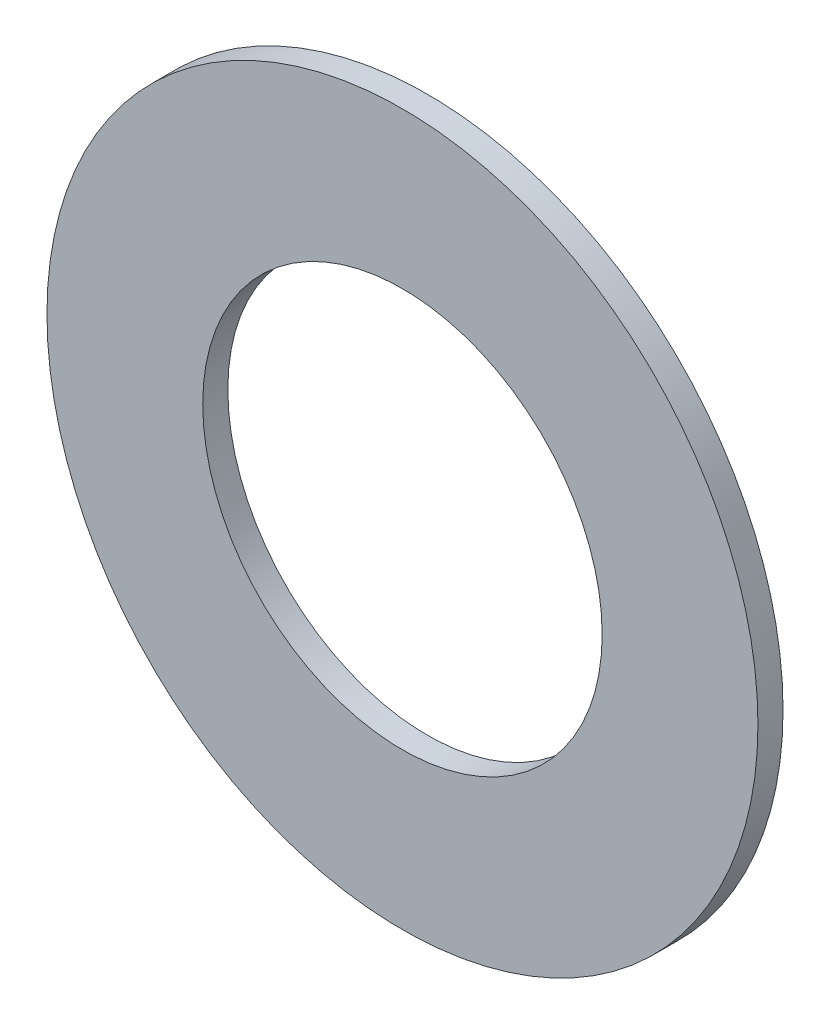
from build123d import *

# Parameters (mm, degrees)
SKETCH3_R           = 22.25
SKETCH3_R_2         = 12.5
BOSS_EXTRUDE1_DEPTH = 1.57


with BuildPart() as part:
    # Sketch3 → Boss-Extrude1 (new body)
    with BuildSketch(Plane.XY):
        Circle(SKETCH3_R)
        Circle(SKETCH3_R_2, mode=Mode.SUBTRACT)
    extrude(amount=-BOSS_EXTRUDE1_DEPTH)


solid = part.part
